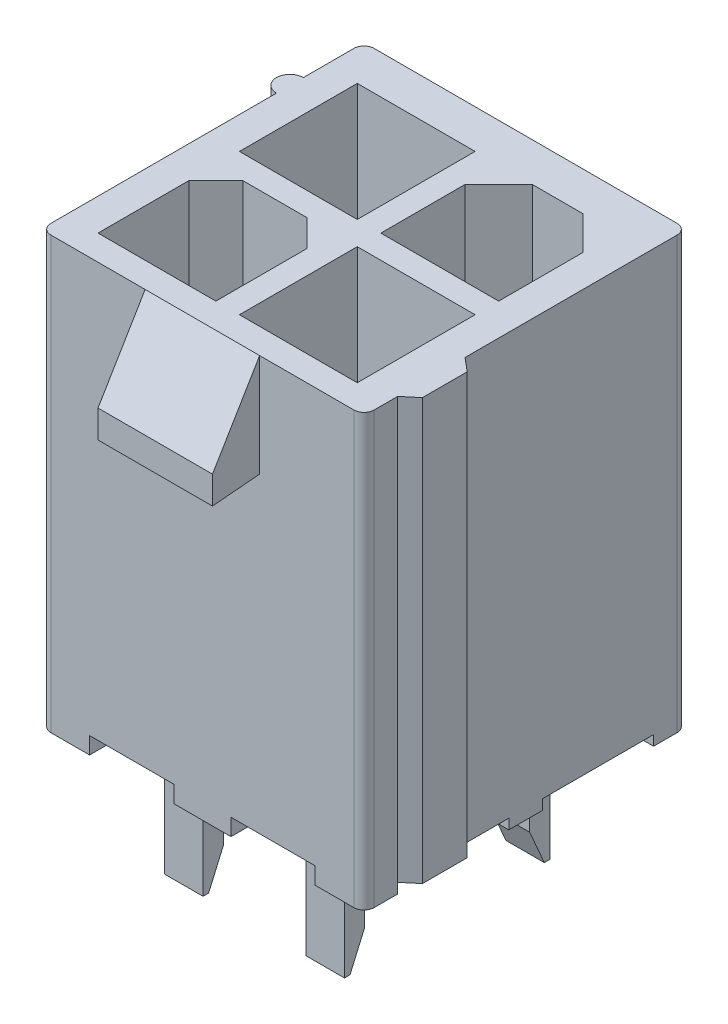
from build123d import *

# Parameters (mm, degrees)
BOSS_EXTRUDE1_DEPTH  = 12.5
BOSS_EXTRUDE2_DEPTH  = 3.4
BOSS_EXTRUDE3_DEPTH  = 3.5000000000000004
SKETCH4_W            = 0.40000000000000124
SKETCH4_H            = 6.935639852470931
CUT_EXTRUDE1_DEPTH   = 15.890601062415177
CUT_EXTRUDE2_DEPTH   = 18.660124574872064
BOSS_EXTRUDE4_DEPTH  = 0.29999999999999993
SKETCH7_W            = 1.7000000000000002
SKETCH7_H            = 9.6
BOSS_EXTRUDE5_DEPTH  = 0.5000000000000003
BOSS_EXTRUDE6_DEPTH  = 0.3
CUT_EXTRUDE3_DEPTH   = 15.890601062415183
SKETCH10_W           = 1.4499999999999997
SKETCH10_H           = 1
BOSS_EXTRUDE7_DEPTH  = 0.3
BOSS_EXTRUDE8_DEPTH  = 0.3
BOSS_EXTRUDE9_START  = 0.3
BOSS_EXTRUDE9_DEPTH  = 0.3
SKETCH13_W           = 3.3000000000000003
SKETCH13_H           = 0.3
CUT_EXTRUDE4_DEPTH   = 16.455824144962317
SKETCH14_W           = 3.3
SKETCH14_H           = 0.3
CUT_EXTRUDE5_DEPTH   = 1.7
SKETCH15_W           = 3.3
SKETCH15_H           = 0.3
CUT_EXTRUDE6_DEPTH   = 18.38620142526826
CUT_EXTRUDE7_REACH   = 19.386
SKETCH16_W           = 3.3
SKETCH16_H           = 0.3
BOSS_EXTRUDE10_DEPTH = 1.14
BOSS_EXTRUDE11_DEPTH = 1.14
BOSS_EXTRUDE12_DEPTH = 1.14
BOSS_EXTRUDE13_DEPTH = 1.14
CUT_EXTRUDE8_DEPTH   = 9.1
SKETCH22_W           = 1.1399999999999995
SKETCH22_H           = 1.1400000000000003
BOSS_EXTRUDE14_DEPTH = 5.6000000000000005
SKETCH23_W           = 3.5
SKETCH23_H           = 3.4999999999999996
CUT_EXTRUDE9_DEPTH   = 9.1
SKETCH24_W           = 1.14
SKETCH24_H           = 1.1400000000000003
BOSS_EXTRUDE15_DEPTH = 5.6000000000000005
CUT_EXTRUDE10_DEPTH  = 9.1
BOSS_EXTRUDE16_DEPTH = 5.6000000000000005
SKETCH27_W           = 3.5
SKETCH27_H           = 3.4999999999999996
CUT_EXTRUDE11_DEPTH  = 9.1
SKETCH28_W           = 1.1399999999999995
SKETCH28_H           = 1.1400000000000006
BOSS_EXTRUDE17_DEPTH = 5.6000000000000005
DRAFT1_ANGLE         = -5.000000000000134
DRAFT2_ANGLE         = 39.99999999999766
CHAMFER1_SIZE        = 1.0000000000000708
CHAMFER2_SIZE        = 0.7999999999999999
FILLET1_R            = 0.3


with BuildPart() as part:
    # Sketch1 → Boss-Extrude1 (new body)
    with BuildSketch(Plane.XZ.offset(-0.3)):
        with BuildLine():
            Line((-4.8, -4.8), (1.7000000000000002, -4.8))
            Line((1.7000000000000002, -4.8), (1.7000000000000002, 4.800000000000001))
            Line((1.7000000000000002, 4.800000000000001), (-4.8, 4.8))
            Line((-4.8, 4.8), (-4.8, -2.2))
            ThreePointArc((-4.8, -2.2), (-5.2, -2.6000000000000005), (-4.8, -3.0000000000000004))
            Line((-4.8, -3.0000000000000004), (-4.8, -4.8))
        make_face()
    extrude(amount=-BOSS_EXTRUDE1_DEPTH)

    # Sketch2 → Boss-Extrude2 (add)
    with BuildSketch(Plane(origin=(1.7, 0, 0), x_dir=(0, 0, -1), z_dir=(1, 0, 0))):
        Polygon((-4.800000000000008, 12.800000000000006), (-6.200000000000001, 10.45), (-6.200000000000001, 9.627515871063899), (-4.800000000000008, 9.627515871063899), align=None)
    extrude(amount=-BOSS_EXTRUDE2_DEPTH)

    # Sketch3 → Boss-Extrude3 (add)
    with BuildSketch(Plane(origin=(1.7000000000000002, 0, 0), x_dir=(0, 0, -1), z_dir=(1, 0, 0))):
        Polygon((4.8, 0.29999999999999993), (-4.800000000000001, 0.29999999999999993), (-4.8, 12.8), (4.8, 12.8), align=None)
    extrude(amount=BOSS_EXTRUDE3_DEPTH)

    # Sketch4 → Cut-Extrude1 (cut, through all)
    with BuildSketch(Plane(origin=(0, 12.8, 0), x_dir=(-1, 0, 0), z_dir=(0, 1, 0))):
        with Locations((-5, -1.3321800737645344)):
            Rectangle(SKETCH4_W, SKETCH4_H)
    extrude(amount=-CUT_EXTRUDE1_DEPTH, mode=Mode.SUBTRACT)

    # Sketch5 → Cut-Extrude2 (cut, through all)
    with BuildSketch(Plane(origin=(0, 0, -4.8), x_dir=(-1, 0, 0), z_dir=(0, 0, -1))):
        Polygon((-3.35, 0.29999999999999993), (3.3499999999999996, 0.29999999999999993), (3.35, 0.5000000000000001), (-3.35, 0.5000000000000004), align=None)
    extrude(amount=-CUT_EXTRUDE2_DEPTH, mode=Mode.SUBTRACT)

    # Sketch6 → Boss-Extrude4 (add)
    with BuildSketch(Plane.XZ.offset(-0.3)):
        Polygon((4.8, -4.8), (3.35, -4.8), (3.35, 0.49999999999999956), (4.8, 0.5), align=None)
    extrude(amount=BOSS_EXTRUDE4_DEPTH)

    # Sketch7 → Boss-Extrude5 (add)
    with BuildSketch(Plane.XZ.offset(-0.5000000000000002)):
        Rectangle(SKETCH7_W, SKETCH7_H)
    extrude(amount=BOSS_EXTRUDE5_DEPTH)

    # Sketch8 → Boss-Extrude6 (add)
    with BuildSketch(Plane.XZ.offset(-0.3)):
        Polygon((-4.8, -4.8), (-4.8, -3.8), (-3.3499999999999996, -3.8), (-3.35, -4.8), align=None)
    extrude(amount=BOSS_EXTRUDE6_DEPTH)

    # Sketch9 → Cut-Extrude3 (cut, through all)
    with BuildSketch(Plane.XZ.offset(-0.3)):
        Polygon((5.200000000000001, 4.800000000000001), (4.8, 4.800000000000001), (4.8, 3.464360147529), (5.200000000000001, 3.4643601475289993), align=None)
    extrude(amount=-CUT_EXTRUDE3_DEPTH, mode=Mode.SUBTRACT)

    # Sketch10 → Boss-Extrude7 (add)
    with BuildSketch(Plane.XZ.offset(-0.3)):
        with Locations((4.075, 4.3)):
            Rectangle(SKETCH10_W, SKETCH10_H)
    extrude(amount=BOSS_EXTRUDE7_DEPTH)

    # Sketch11 → Boss-Extrude8 (add)
    with BuildSketch(Plane.XZ.offset(-0.3)):
        Polygon((-4.8, 4.8), (-3.3499999999999996, 4.8), (-3.35, -0.49999999999999956), (-4.8, -0.5), align=None)
    extrude(amount=BOSS_EXTRUDE8_DEPTH)

    # Sketch12 → Boss-Extrude9 (add)
    with BuildSketch(Plane.XZ.offset(-0.3).offset(BOSS_EXTRUDE9_START)):
        with BuildLine():
            Line((-4.8, -2.2), (-4.8, -3.0000000000000004))
            ThreePointArc((-4.8, -3.0000000000000004), (-5.199999999999999, -2.6000000000000005), (-4.8, -2.2))
        make_face()
    extrude(amount=-BOSS_EXTRUDE9_DEPTH)

    # Sketch13 → Cut-Extrude4 (cut, through all)
    with BuildSketch(Plane.ZY.offset(0.8500000000000001)):
        with Locations((2.15, 0.15000000000000005)):
            Rectangle(SKETCH13_W, SKETCH13_H)
    extrude(amount=-CUT_EXTRUDE4_DEPTH, mode=Mode.SUBTRACT)

    # Sketch14 → Cut-Extrude5 (cut)
    with BuildSketch(Plane.ZY.offset(0.8500000000000001)):
        with Locations((-2.15, 0.15000000000000005)):
            Rectangle(SKETCH14_W, SKETCH14_H)
    extrude(amount=-CUT_EXTRUDE5_DEPTH, mode=Mode.SUBTRACT)

    # Sketch15 → Cut-Extrude6 (cut, through all)
    with BuildSketch(Plane.ZY.offset(4.8)):
        with Locations((2.15, 0.15)):
            Rectangle(SKETCH15_W, SKETCH15_H)
    extrude(amount=-CUT_EXTRUDE6_DEPTH, mode=Mode.SUBTRACT)

    # Sketch16 → Cut-Extrude7 (cut, up to next)
    with BuildSketch(Plane(origin=(4.8, 0, 0), x_dir=(0, 0, -1), z_dir=(1, 0, 0)), mode=Mode.PRIVATE) as cut_extrude7_sk1:
        with Locations((2.15, 0.15)):
            Rectangle(SKETCH16_W, SKETCH16_H)
    cut_extrude7_tool1 = extrude(cut_extrude7_sk1.sketch, amount=-CUT_EXTRUDE7_REACH, mode=Mode.PRIVATE) & part.part
    add(cut_extrude7_tool1.solids().sort_by_distance((4.8, 0.15, -2.15))[0], mode=Mode.SUBTRACT)

    # Sketch17 → Boss-Extrude10 (add)
    with BuildSketch(Plane(origin=(1.53, 0, 0), x_dir=(0, -1, 0), z_dir=(-1, 0, 0))):
        Polygon((2.500000000000003, 2.6499999999999937), (3.5, 3.085), (3.5, 3.2500000000000004), (-0.5, 3.2500000000000004), (-0.5, 2.6500000000000004), align=None)
    extrude(amount=-BOSS_EXTRUDE10_DEPTH)

    # Sketch18 → Boss-Extrude11 (add)
    with BuildSketch(Plane(origin=(1.53, 0, 0), x_dir=(0, -1, 0), z_dir=(-1, 0, 0))):
        Polygon((3.5, -2.85), (3.4999999999999987, -2.685000000000003), (2.5000000000000004, -2.2500000000000004), (-0.5, -2.2500000000000004), (-0.5, -2.85), align=None)
    extrude(amount=-BOSS_EXTRUDE11_DEPTH)

    # Sketch19 → Boss-Extrude12 (add)
    with BuildSketch(Plane(origin=(-2.6700000000000004, 0, 0), x_dir=(0, -1, 0), z_dir=(-1, 0, 0))):
        Polygon((2.500000000000003, 2.6499999999999937), (3.5, 3.085), (3.5, 3.2500000000000004), (-0.5, 3.2500000000000004), (-0.5, 2.6500000000000004), align=None)
    extrude(amount=-BOSS_EXTRUDE12_DEPTH)

    # Sketch20 → Boss-Extrude13 (add)
    with BuildSketch(Plane(origin=(-2.6700000000000004, 0, 0), x_dir=(0, -1, 0), z_dir=(-1, 0, 0))):
        Polygon((3.5, -2.85), (3.4999999999999987, -2.685000000000003), (2.5000000000000004, -2.2500000000000004), (-0.5, -2.2500000000000004), (-0.5, -2.85), align=None)
    extrude(amount=-BOSS_EXTRUDE13_DEPTH)

    # Sketch21 → Cut-Extrude8 (cut)
    with BuildSketch(Plane(origin=(0, 12.8, 0), x_dir=(-1, 0, 0), z_dir=(0, 1, 0))):
        Polygon((0.3499999999999999, 4.05), (0.34999999999999964, 0.5500000000000002), (3.85, 0.5500000000000002), (3.85, 4.05), align=None)
    extrude(amount=-CUT_EXTRUDE8_DEPTH, mode=Mode.SUBTRACT)

    # Sketch22 → Boss-Extrude14 (add)
    with BuildSketch(Plane(origin=(0, 3.7, 0), x_dir=(-1, 0, 0), z_dir=(0, 1, 0))):
        with Locations((2.0999999999999996, 2.3)):
            Rectangle(SKETCH22_W, SKETCH22_H)
    extrude(amount=BOSS_EXTRUDE14_DEPTH)

    # Sketch23 → Cut-Extrude9 (cut)
    with BuildSketch(Plane(origin=(0, 12.8, 0), x_dir=(-1, 0, 0), z_dir=(0, 1, 0))):
        with Locations((-2.1, 2.3)):
            Rectangle(SKETCH23_W, SKETCH23_H)
    extrude(amount=-CUT_EXTRUDE9_DEPTH, mode=Mode.SUBTRACT)

    # Sketch24 → Boss-Extrude15 (add)
    with BuildSketch(Plane(origin=(0, 3.7, 0), x_dir=(-1, 0, 0), z_dir=(0, 1, 0))):
        with Locations((-2.1, 2.3)):
            Rectangle(SKETCH24_W, SKETCH24_H)
    extrude(amount=BOSS_EXTRUDE15_DEPTH)

    # Sketch25 → Cut-Extrude10 (cut)
    with BuildSketch(Plane(origin=(0, 12.8, 0), x_dir=(-1, 0, 0), z_dir=(0, 1, 0))):
        Polygon((-3.85, -0.14999999999999997), (-3.85, -3.6499999999999995), (-0.3499999999999998, -3.6499999999999995), (-0.3499999999999999, -0.14999999999999997), align=None)
    extrude(amount=-CUT_EXTRUDE10_DEPTH, mode=Mode.SUBTRACT)

    # Sketch26 → Boss-Extrude16 (add)
    with BuildSketch(Plane(origin=(0, 3.7, 0), x_dir=(-1, 0, 0), z_dir=(0, 1, 0))):
        Polygon((-2.67, -2.4700000000000006), (-2.67, -1.3300000000000003), (-1.53, -1.33), (-1.53, -2.4700000000000006), align=None)
    extrude(amount=BOSS_EXTRUDE16_DEPTH)

    # Sketch27 → Cut-Extrude11 (cut)
    with BuildSketch(Plane(origin=(0, 12.8, 0), x_dir=(-1, 0, 0), z_dir=(0, 1, 0))):
        with Locations((2.1, -1.8999999999999997)):
            Rectangle(SKETCH27_W, SKETCH27_H)
    extrude(amount=-CUT_EXTRUDE11_DEPTH, mode=Mode.SUBTRACT)

    # Sketch28 → Boss-Extrude17 (add)
    with BuildSketch(Plane(origin=(0, 3.7, 0), x_dir=(-1, 0, 0), z_dir=(0, 1, 0))):
        with Locations((2.0999999999999996, -1.9000000000000004)):
            Rectangle(SKETCH28_W, SKETCH28_H)
    extrude(amount=BOSS_EXTRUDE17_DEPTH)

    # Draft1
    draft1_faces = [part.faces().sort_by_distance(p)[0] for p in [
        (-5e-17, 9.627515871063899, 5.500000000000004),
    ]]
    draft(draft1_faces, Plane(origin=(-1.7, 10.45, 6.200000000000001), x_dir=(1, 0, 0), z_dir=(0, 0, 1)), DRAFT1_ANGLE)

    # Draft2
    draft2_faces = [part.faces().sort_by_distance(p)[0] for p in [
        (5.000000000000001, 6.550000000000001, 3.4643601475290002),
        (5.000000000000001, 6.550000000000001, 2.135639852470931),
    ]]
    draft(draft2_faces, Plane(origin=(5.200000000000001, 0, 0), x_dir=(0, 0, 1), z_dir=(1, 0, 0)), DRAFT2_ANGLE)

    # Chamfer1
    chamfer1_edges = [part.edges().sort_by_distance(p)[0] for p in [
        (0.3499999999999998, 8.25, -3.6499999999999995),
        (3.85, 8.25, -3.6499999999999995),
    ]]
    chamfer(chamfer1_edges, length=CHAMFER1_SIZE)

    # Chamfer2
    chamfer2_edges = [part.edges().sort_by_distance(p)[0] for p in [
        (-3.85, 8.25, 0.5500000000000002),
        (-0.34999999999999964, 8.25, 0.5500000000000002),
    ]]
    chamfer(chamfer2_edges, length=CHAMFER2_SIZE)

    # Fillet1
    fillet1_edges = [part.edges().sort_by_distance(p)[0] for p in [
        (-4.8, 6.4, 4.8),
        (-4.8, 6.4, -4.8),
        (4.8, 6.4, 4.800000000000001),
        (4.8, 6.4, -4.8),
    ]]
    fillet(fillet1_edges, radius=FILLET1_R)


solid = part.part
